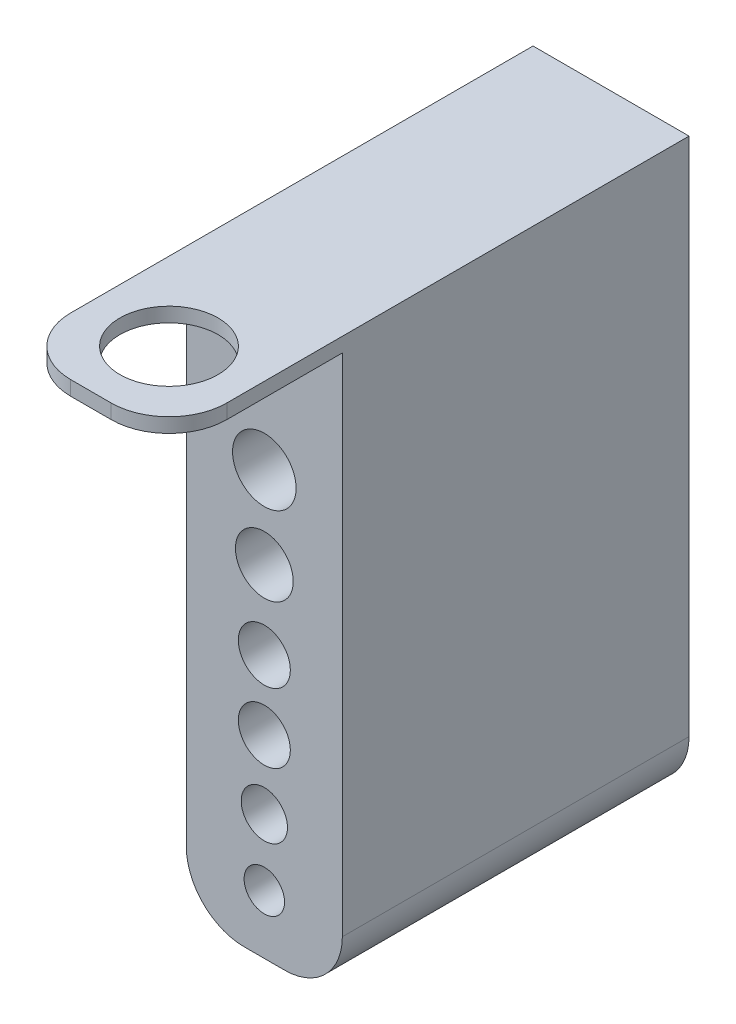
from build123d import *

# Parameters (mm, degrees)
SKETCH1_W           = 27
SKETCH1_H           = 100
BOSS_EXTRUDE1_DEPTH = 60
FILLET1_R           = 10
SKETCH2_W           = 27
SKETCH2_H           = 2.5
BOSS_EXTRUDE2_DEPTH = 30
FILLET2_R           = 10
SKETCH3_R           = 8.5
CUT_EXTRUDE1_DEPTH  = 134.373535606
SKETCH4_R           = 5.5
SKETCH4_R_2         = 5
SKETCH4_R_3         = 4.5
SKETCH4_R_4         = 4
SKETCH4_R_5         = 3.5
CUT_EXTRUDE2_DEPTH  = 57


with BuildPart() as part:
    # Sketch1 → Boss-Extrude1 (new body)
    with BuildSketch(Plane.XY):
        Rectangle(SKETCH1_W, SKETCH1_H)
    extrude(amount=BOSS_EXTRUDE1_DEPTH)

    # Fillet1
    fillet1_edges = [part.edges().sort_by_distance(p)[0] for p in [
        (13.5, -50, 30),
        (-13.5, -50, 30),
    ]]
    fillet(fillet1_edges, radius=FILLET1_R)

    # Sketch2 → Boss-Extrude2 (add)
    with BuildSketch(Plane.XY.offset(60)):
        with Locations((0, 48.75)):
            Rectangle(SKETCH2_W, SKETCH2_H)
    extrude(amount=BOSS_EXTRUDE2_DEPTH)

    # Fillet2
    fillet2_edges = [part.edges().sort_by_distance(p)[0] for p in [
        (-13.5, 48.75, 90),
        (13.5, 48.75, 90),
    ]]
    fillet(fillet2_edges, radius=FILLET2_R)

    # Sketch3 → Cut-Extrude1 (cut, through all)
    with BuildSketch(Plane.XZ.offset(-47.5)):
        with Locations(Location((0, 76.5, 0), (0, 0, 270))):
            Circle(SKETCH3_R)
    extrude(amount=-CUT_EXTRUDE1_DEPTH, mode=Mode.SUBTRACT)

    # Sketch4 → Cut-Extrude2 (cut)
    with BuildSketch(Plane.XY.offset(60)):
        with Locations((0, 23.219556201)):
            Circle(SKETCH4_R)
        with Locations((0, 8.994963213)):
            Circle(SKETCH4_R_2)
        with Locations((0, -4.532345805)):
            Circle(SKETCH4_R_3)
        with Locations((0, -16.525630089)):
            Circle(SKETCH4_R_3)
        with Locations((0, -28.379457578)):
            Circle(SKETCH4_R_4)
        with Locations((0, -39.814914686)):
            Circle(SKETCH4_R_5)
    extrude(amount=-CUT_EXTRUDE2_DEPTH, mode=Mode.SUBTRACT)


solid = part.part
